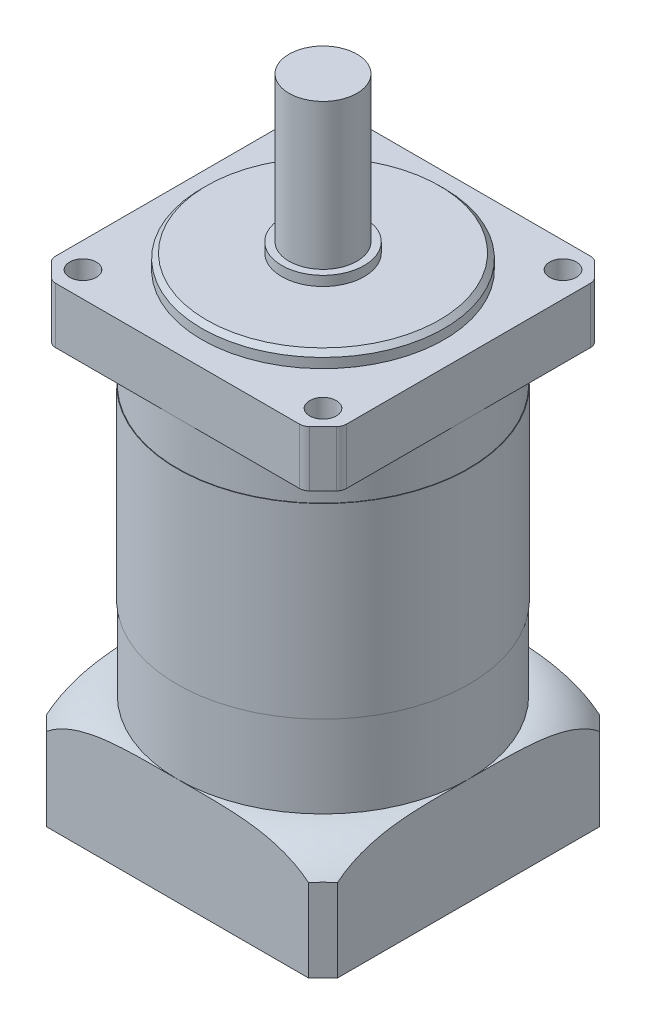
from build123d import *

# Parameters (mm, degrees)
IZIM1_W                      = 60
IZIM1_H                      = 60
Y_KSEKLIK_EKSTR_ZYON1_DEPTH  = 11.5
PAH1_SIZE                    = 4
IZIM2_R                      = 25
Y_KSEKLIK_EKSTR_ZYON2_DEPTH  = 3
PAH2_SIZE                    = 1
RADYUS1_R                    = 2
IZIM3_R                      = 30
Y_KSEKLIK_EKSTR_ZYON3_DEPTH  = 64.5
IZIM4_W                      = 60
IZIM4_H                      = 60
Y_KSEKLIK_EKSTR_ZYON4_DEPTH  = 22
PAH3_SIZE                    = 3
IZIM19_R                     = 8.5
Y_KSEKLIK_EKSTR_ZYON12_DEPTH = 2
IZIM20_R                     = 7
Y_KSEKLIK_EKSTR_ZYON13_DEPTH = 30
IZIM22_R                     = 2.75
KES_EKSTR_ZYON2_DEPTH        = 11.5
IZIM23_W                     = 0.1
IZIM23_H                     = 38.5
IZIM25_R                     = 2.6
KES_EKSTR_ZYON4_DEPTH        = 10


with BuildPart() as part:
    # Çizim1 → Yükseklik-Ekstrüzyon1 (new body)
    with BuildSketch(Plane(origin=(0, 0, 0), x_dir=(1, 0, 0), z_dir=(0, 1, 0))):
        Rectangle(IZIM1_W, IZIM1_H)
    extrude(amount=Y_KSEKLIK_EKSTR_ZYON1_DEPTH)

    # Pah1
    pah1_edges = [part.edges().sort_by_distance(p)[0] for p in [
        (30, 5.75, 30),
        (-30, 5.75, 30),
        (-30, 5.75, -30),
        (30, 5.75, -30),
    ]]
    chamfer(pah1_edges, length=PAH1_SIZE)

    # Çizim2 → Yükseklik-Ekstrüzyon2 (add)
    with BuildSketch(Plane(origin=(0, 11.5, 0), x_dir=(1, 0, 0), z_dir=(0, 1, 0))):
        with Locations(Location((0, 0, 0), (0, 0, 270))):
            Circle(IZIM2_R)
    extrude(amount=Y_KSEKLIK_EKSTR_ZYON2_DEPTH)

    # Pah2
    pah2_edges = [part.edges().sort_by_distance(p)[0] for p in [
        (0, 14.5, -25),
    ]]
    chamfer(pah2_edges, length=PAH2_SIZE)

    # Radyus1
    radyus1_edges = [part.edges().sort_by_distance(p)[0] for p in [
        (-30, 5.75, 26),
        (-30, 5.75, -26),
        (26, 5.75, -30),
        (-26, 5.75, -30),
        (26, 5.75, 30),
        (-26, 5.75, 30),
        (30, 5.75, 26),
        (30, 5.75, -26),
    ]]
    fillet(radyus1_edges, radius=RADYUS1_R)

    # Çizim3 → Yükseklik-Ekstrüzyon3 (add)
    with BuildSketch(Plane.XZ):
        with Locations(Location((0, 0, 0), (0, 0, 270))):
            Circle(IZIM3_R)
    extrude(amount=Y_KSEKLIK_EKSTR_ZYON3_DEPTH)

    # Çizim4 → Yükseklik-Ekstrüzyon4 (add)
    with BuildSketch(Plane.XZ.offset(64.5)):
        Rectangle(IZIM4_W, IZIM4_H)
    extrude(amount=Y_KSEKLIK_EKSTR_ZYON4_DEPTH)

    # Pah3
    pah3_edges = [part.edges().sort_by_distance(p)[0] for p in [
        (30, -75.5, -30),
        (30, -75.5, 30),
        (-30, -75.5, 30),
        (-30, -75.5, -30),
    ]]
    chamfer(pah3_edges, length=PAH3_SIZE)

    # Çizim8 → Kes-Döndür2 (revolve, cut)
    with BuildSketch(Plane(origin=(0, 0, 0), x_dir=(0, 0, -1), z_dir=(1, 0, 0))):
        with BuildLine():
            Line((-30, -64.5), (-40.4, -64.5))
            Line((-40.4, -64.5), (-40.4, -69.5))
            ThreePointArc((-40.4, -69.5), (-35.769748695, -65.814922715), (-30, -64.5))
        make_face()
    revolve(axis=Axis((0, -86.5, 0), (0, 1, 0)), mode=Mode.SUBTRACT)

    # Çizim19 → Yükseklik-Ekstrüzyon12 (add)
    with BuildSketch(Plane(origin=(0, 14.5, 0), x_dir=(1, 0, 0), z_dir=(0, 1, 0))):
        with Locations(Location((0, 0, 0), (0, 0, 270))):
            Circle(IZIM19_R)
    extrude(amount=Y_KSEKLIK_EKSTR_ZYON12_DEPTH)

    # Çizim20 → Yükseklik-Ekstrüzyon13 (add)
    with BuildSketch(Plane(origin=(0, 16.5, 0), x_dir=(1, 0, 0), z_dir=(0, 1, 0))):
        with Locations(Location((0, 0, 0), (0, 0, 270))):
            Circle(IZIM20_R)
    extrude(amount=Y_KSEKLIK_EKSTR_ZYON13_DEPTH)

    # Çizim22 → Kes-Ekstrüzyon2 (cut)
    with BuildSketch(Plane(origin=(0, 11.5, 0), x_dir=(1, 0, 0), z_dir=(0, 1, 0))):
        with Locations(Location((-24.748737342, 24.748737342, 0), (0, 0, 270))):
            Circle(IZIM22_R)
        with Locations(Location((24.748737342, 24.748737342, 0), (0, 0, 270))):
            Circle(IZIM22_R)
        with Locations(Location((24.748737342, -24.748737342, 0), (0, 0, 270))):
            Circle(IZIM22_R)
        with Locations(Location((-24.748737342, -24.748737342, 0), (0, 0, 270))):
            Circle(IZIM22_R)
    extrude(amount=-KES_EKSTR_ZYON2_DEPTH, mode=Mode.SUBTRACT)

    # Çizim23 → Döndür1 (revolve)
    with BuildSketch(Plane.XY, mode=Mode.PRIVATE) as d_nd_r1_sk:
        with Locations((-30.05, -28.25)):
            Rectangle(IZIM23_W, IZIM23_H)
    revolve(d_nd_r1_sk.sketch.rotate(Axis((0, -64.5, 0), (0, 1, 0)), 270), axis=Axis((0, -64.5, 0), (0, 1, 0)))

    # Çizim25 → Kes-Ekstrüzyon4 (cut)
    with BuildSketch(Plane(origin=(0, -86.5, 0), x_dir=(-1, 0, 0), z_dir=(0, -1, 0))):
        with Locations(Location((23.55, -23.55, 0), (0, 0, 90))):
            Circle(IZIM25_R)
        with Locations(Location((-23.55, -23.55, 0), (0, 0, 90))):
            Circle(IZIM25_R)
        with Locations(Location((23.55, 23.55, 0), (0, 0, 90))):
            Circle(IZIM25_R)
        with Locations(Location((-23.55, 23.55, 0), (0, 0, 90))):
            Circle(IZIM25_R)
    extrude(amount=-KES_EKSTR_ZYON4_DEPTH, mode=Mode.SUBTRACT)


solid = part.part
